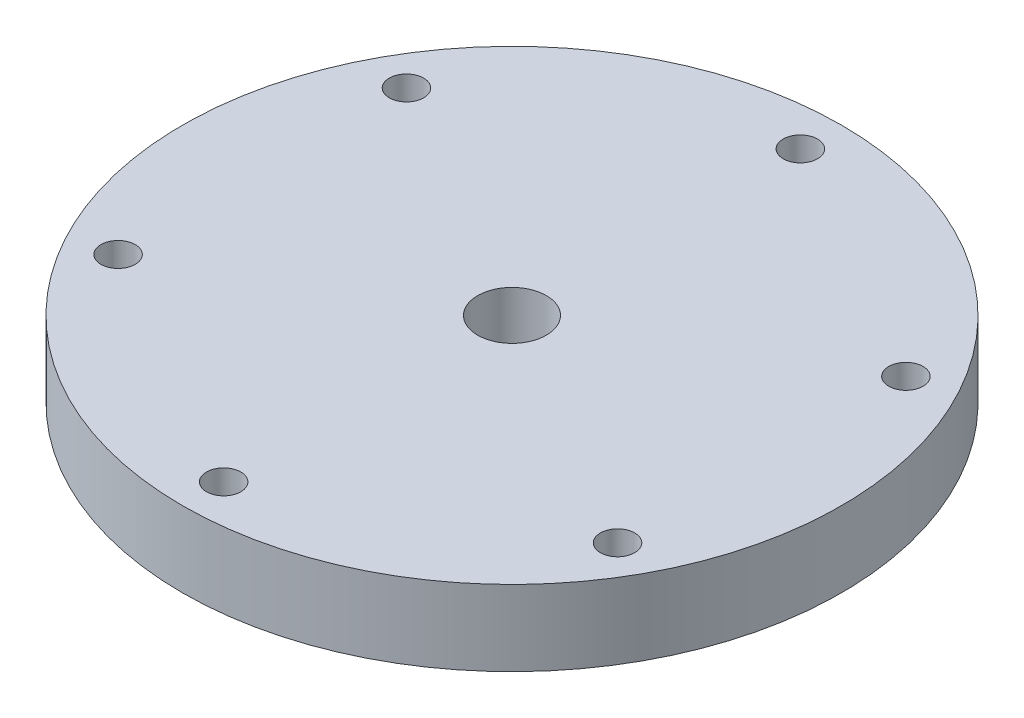
from build123d import *

# Parameters (mm, degrees)
SKETCH_1_R               = 24
EXTRUDE_1_DEPTH          = 2.75
SKETCH_4_R               = 2.5
CUT_EXTRUDE_1_DEPTH      = 22
SKETCH_6_R               = 1.25
CUT_EXTRUDE_3_DEPTH      = 3
PATTERN_CIRCULAR_1_COUNT = 6
SCALE_1_SCALE            = 1.5


with BuildPart() as part:
    # 草图1 → 凸台-拉伸1 (new, symmetric)
    with BuildSketch(Plane(origin=(0, 0, 0), x_dir=(1, 0, 0), z_dir=(0, 1, 0))):
        with Locations(Location((0, 0, 0), (0, 0, 270))):
            Circle(SKETCH_1_R)
    extrude(amount=EXTRUDE_1_DEPTH, both=True)

    # 草图4 → 切除-拉伸1 (cut)
    with BuildSketch(Plane(origin=(0, 2.75, 0), x_dir=(1, 0, 0), z_dir=(0, 1, 0))):
        with Locations(Location((0, 0, 0), (0, 0, 270))):
            Circle(SKETCH_4_R)
    extrude(amount=-CUT_EXTRUDE_1_DEPTH, mode=Mode.SUBTRACT)

    # 草图6 → 切除-拉伸3 (cut)
    with BuildSketch(Plane(origin=(0, 2.75, 0), x_dir=(1, 0, 0), z_dir=(0, 1, 0))):
        with Locations(Location((0, 21, 0), (0, 0, 270))):
            Circle(SKETCH_6_R)
    cut_extrude_3 = extrude(amount=-CUT_EXTRUDE_3_DEPTH, mode=Mode.SUBTRACT)

    # 阵列(圆周)1: 切除-拉伸3 ×6 about axis
    pattern_circular_1_axis = Axis((0, 0, 0), (0, 1, 0))
    for i in range(1, PATTERN_CIRCULAR_1_COUNT):
        add(cut_extrude_3.rotate(pattern_circular_1_axis, i * 360 / PATTERN_CIRCULAR_1_COUNT), mode=Mode.SUBTRACT)


with BuildPart() as part_1:
    # 缩放比例1: scaled about (0, -0.011320641, 0)
    add(part.part.scale(SCALE_1_SCALE).moved(Location((0, 0.00566032, 0))))


solid = part_1.part
